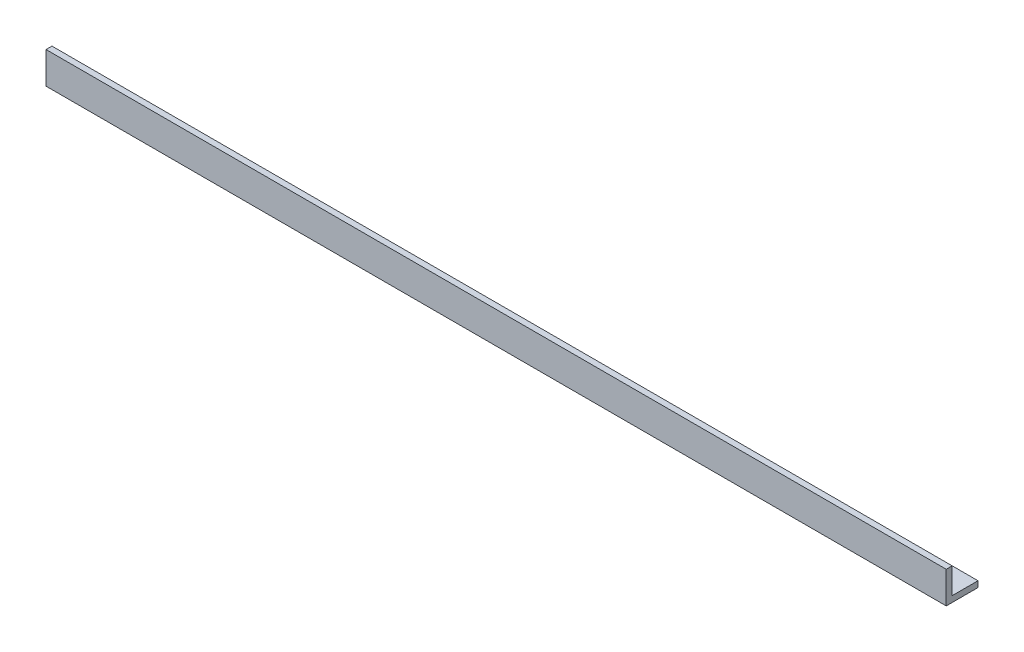
from build123d import *

# Parameters (mm, degrees)
BOSS_EXTRUDE1_DEPTH = 720.09
CUT_EXTRUDE1_REACH  = 722.681
SKETCH3_R           = 3.175


with BuildPart() as part:
    # Sketch1 → Boss-Extrude1 (new body)
    with BuildSketch(Plane(origin=(0, 0, 0), x_dir=(0, 0, -1), z_dir=(1, 0, 0))):
        Polygon((0, 0), (0, -20.6375), (20.6375, -20.6375), (20.6375, -25.4), (-4.7625, -25.4), (-4.7625, 0), align=None)
    extrude(amount=BOSS_EXTRUDE1_DEPTH)

    # Sketch3 → Cut-Extrude1 (cut, up to next)
    with BuildSketch(Plane(origin=(0, -20.6375, 0), x_dir=(1, 0, 0), z_dir=(0, 1, 0)), mode=Mode.PRIVATE) as cut_extrude1_sk1:
        with Locations(Location((38.1, 7.9375, 0), (0, 0, 270))):
            Circle(SKETCH3_R)
    cut_extrude1_tool1 = extrude(cut_extrude1_sk1.sketch, amount=-CUT_EXTRUDE1_REACH, mode=Mode.PRIVATE) & part.part
    add(cut_extrude1_tool1.solids().sort_by_distance((38.1, -20.6375, -7.9375))[0], mode=Mode.SUBTRACT)


solid = part.part
